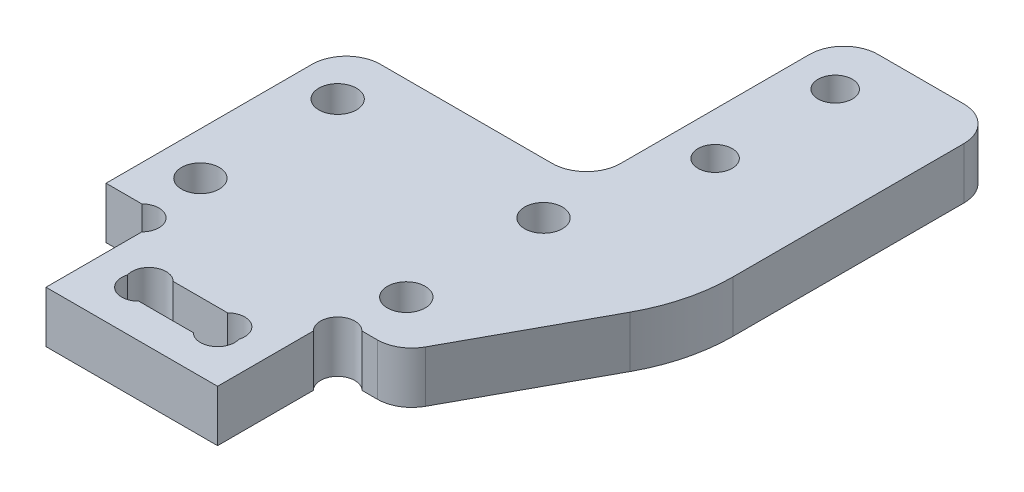
from build123d import *

# Parameters (mm, degrees)
SKETCH_1_W          = 17
SKETCH_1_H          = 14
SKETCH_1_R          = 1.1
EXTRUDE_1_DEPTH     = 3
EXTRUDE_3_DEPTH     = 3
SKETCH_3_R          = 1
CUT_EXTRUDE_1_DEPTH = 27.518861212
SKETCH_4_W          = 10
SKETCH_4_H          = 7
SKETCH_4_W_2        = 6
SKETCH_4_H_2        = 2
EXTRUDE_4_DEPTH     = 3
SKETCH_7_R          = 1
CUT_EXTRUDE_4_DEPTH = 27.518861212
FILLET_1_R          = 10
FILLET_2_R          = 2
CUT_EXTRUDE_5_DEPTH = 27.518861212


with BuildPart() as part:
    # 草图1 → 凸台-拉伸1 (new body)
    with BuildSketch(Plane(origin=(0, 0, 0), x_dir=(1, 0, 0), z_dir=(0, 1, 0))):
        Rectangle(SKETCH_1_W, SKETCH_1_H)
        with Locations(Location((-6, 4, 0), (0, 0, 270))):
            Circle(SKETCH_1_R, mode=Mode.SUBTRACT)
        with Locations(Location((6, 4, 0), (0, 0, 90))):
            Circle(SKETCH_1_R, mode=Mode.SUBTRACT)
        with Locations(Location((6, -4, 0), (0, 0, 270))):
            Circle(SKETCH_1_R, mode=Mode.SUBTRACT)
        with Locations(Location((-6, -4, 0), (0, 0, 90))):
            Circle(SKETCH_1_R, mode=Mode.SUBTRACT)
    extrude(amount=EXTRUDE_1_DEPTH)

    # 草图2 → 凸台-拉伸3 (add)
    with BuildSketch(Plane(origin=(0, 3, 0), x_dir=(1, 0, 0), z_dir=(0, 1, 0))):
        Polygon((5.5, 22), (5.5, 7), (8.5, 7), (8.5, -7), (14.5, 4), (14.5, 22), align=None)
    extrude(amount=-EXTRUDE_3_DEPTH)

    # 草图3 → 切除-拉伸1 (cut, through all)
    with BuildSketch(Plane(origin=(0, 3, 0), x_dir=(1, 0, 0), z_dir=(0, 1, 0))):
        with Locations(Location((8, 19, 0), (0, 0, 270))):
            Circle(SKETCH_3_R)
        with Locations(Location((8, 12, 0), (0, 0, 270))):
            Circle(SKETCH_3_R)
    extrude(amount=-CUT_EXTRUDE_1_DEPTH, mode=Mode.SUBTRACT)

    # 草图4 → 凸台-拉伸4 (add)
    with BuildSketch(Plane(origin=(0, 3, 0), x_dir=(1, 0, 0), z_dir=(0, 1, 0))):
        with Locations((0, -10.5)):
            Rectangle(SKETCH_4_W, SKETCH_4_H)
        with Locations((0, -11)):
            Rectangle(SKETCH_4_W_2, SKETCH_4_H_2, mode=Mode.SUBTRACT)
    extrude(amount=-EXTRUDE_4_DEPTH)

    # 草图7 → 切除-拉伸4 (cut, through all)
    with BuildSketch(Plane(origin=(0, 3, 0), x_dir=(1, 0, 0), z_dir=(0, 1, 0))):
        with Locations((5.707106781, -7.707106781)):
            Circle(SKETCH_7_R)
        with Locations((-5.707106781, -7.707106781)):
            Circle(SKETCH_7_R)
    extrude(amount=-CUT_EXTRUDE_4_DEPTH, mode=Mode.SUBTRACT)

    # 圆角1
    fillet_1_edges = [part.edges().sort_by_distance(p)[0] for p in [
        (14.5, 1.5, -4),
    ]]
    fillet(fillet_1_edges, radius=FILLET_1_R)

    # 圆角2
    fillet_2_edges = [part.edges().sort_by_distance(p)[0] for p in [
        (14.5, 1.5, -22),
        (5.5, 1.5, -22),
        (5.5, 1.5, -7),
        (8.5, 1.5, 7),
        (-8.5, 1.5, -7),
    ]]
    fillet(fillet_2_edges, radius=FILLET_2_R)

    # 草图8 → 切除-拉伸5 (cut, through all)
    with BuildSketch(Plane(origin=(0, 3, 0), x_dir=(1, 0, 0), z_dir=(0, 1, 0))):
        with BuildLine():
            ThreePointArc((-1.336748061, -11), (-2.292893219, -9.707106781), (-3.249038376, -11))
            ThreePointArc((-3.249038376, -11), (-2.292893219, -12.292893219), (-1.336748061, -11))
        make_face()
        with BuildLine():
            ThreePointArc((1.336748061, -11), (2.292893219, -12.292893219), (3.249038376, -11))
            ThreePointArc((3.249038376, -11), (2.292893219, -9.707106781), (1.336748061, -11))
        make_face()
    extrude(amount=-CUT_EXTRUDE_5_DEPTH, mode=Mode.SUBTRACT)


solid = part.part
